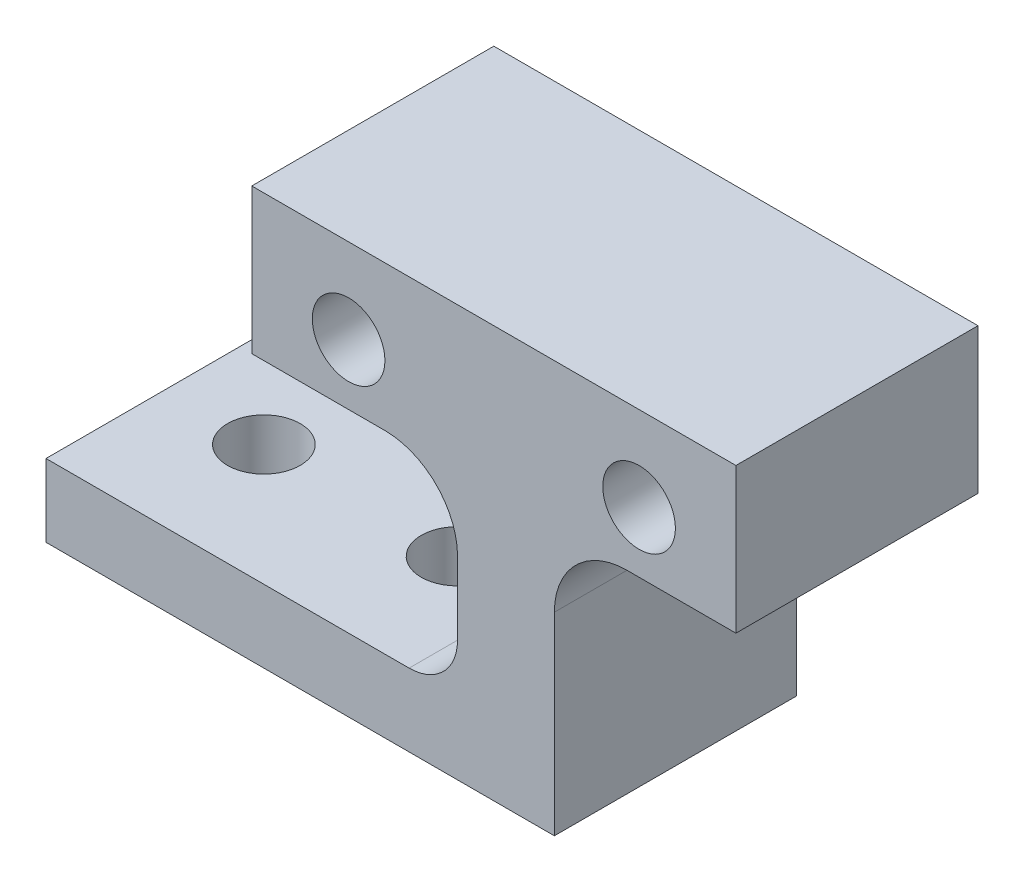
from build123d import *

# Parameters (mm, degrees)
SKETCH_1_W          = 20
SKETCH_1_H          = 10
EXTRUDE_1_DEPTH     = 5
SKETCH_2_R          = 1.5
CUT_EXTRUDE_1_DEPTH = 16
SKETCH_3_W          = 3
SKETCH_3_H          = 10
EXTRUDE_2_DEPTH     = 8
SKETCH_6_W          = 20
SKETCH_6_H          = 10
EXTRUDE_4_DEPTH     = 3
SKETCH_7_R          = 1.5
CUT_EXTRUDE_3_DEPTH = 24.157072354
FILLET_2_R          = 3
FILLET_4_R          = 2
SKETCH_11_W         = 10
SKETCH_11_H         = 11
EXTRUDE_7_DEPTH     = 1
FILLET_8_R          = 3
SKETCH_12_W         = 20
SKETCH_12_H         = 10
EXTRUDE_8_DEPTH     = 1


with BuildPart() as part:
    # 草图1 → 凸台-拉伸1 (new body)
    with BuildSketch(Plane(origin=(0, 0, 0), x_dir=(1, 0, 0), z_dir=(0, 1, 0))):
        Rectangle(SKETCH_1_W, SKETCH_1_H)
    extrude(amount=EXTRUDE_1_DEPTH)

    # 草图2 → 切除-拉伸1 (cut, through all)
    with BuildSketch(Plane.XY.offset(5)):
        with Locations((-6, 2.5)):
            Circle(SKETCH_2_R)
        with Locations((6, 2.5)):
            Circle(SKETCH_2_R)
    extrude(amount=-CUT_EXTRUDE_1_DEPTH, mode=Mode.SUBTRACT)

    # 草图3 → 凸台-拉伸2 (add)
    with BuildSketch(Plane.XZ):
        Rectangle(SKETCH_3_W, SKETCH_3_H)
    extrude(amount=EXTRUDE_2_DEPTH)

    # 草图6 → 凸台-拉伸4 (add)
    with BuildSketch(Plane.XZ.offset(8)):
        with Locations((-8.5, 0)):
            Rectangle(SKETCH_6_W, SKETCH_6_H)
    extrude(amount=EXTRUDE_4_DEPTH)

    # 草图7 → 切除-拉伸3 (cut, through all)
    with BuildSketch(Plane(origin=(0, -8, 0), x_dir=(1, 0, 0), z_dir=(0, 1, 0))):
        with Locations(Location((-14.5, 0, 0), (0, 0, 270))):
            Circle(SKETCH_7_R)
        with Locations(Location((-6.5, 0, 0), (0, 0, 270))):
            Circle(SKETCH_7_R)
    extrude(amount=-CUT_EXTRUDE_3_DEPTH, mode=Mode.SUBTRACT)

    # 圆角2
    fillet_2_edges = [part.edges().sort_by_distance(p)[0] for p in [
        (-1.5, 0, 0),
    ]]
    fillet(fillet_2_edges, radius=FILLET_2_R)

    # 圆角4
    fillet_4_edges = [part.edges().sort_by_distance(p)[0] for p in [
        (-1.5, -8, 0),
    ]]
    fillet(fillet_4_edges, radius=FILLET_4_R)

    # 草图11 → 凸台-拉伸7 (add)
    with BuildSketch(Plane(origin=(1.5, 0, 0), x_dir=(0, 0, -1), z_dir=(1, 0, 0))):
        with Locations((0, -5.5)):
            Rectangle(SKETCH_11_W, SKETCH_11_H)
    extrude(amount=EXTRUDE_7_DEPTH)

    # 圆角8
    fillet_8_edges = [part.edges().sort_by_distance(p)[0] for p in [
        (2.5, 0, 0),
    ]]
    fillet(fillet_8_edges, radius=FILLET_8_R)

    # 草图12 → 凸台-拉伸8 (add)
    with BuildSketch(Plane(origin=(0, 5, 0), x_dir=(1, 0, 0), z_dir=(0, 1, 0))):
        Rectangle(SKETCH_12_W, SKETCH_12_H)
    extrude(amount=EXTRUDE_8_DEPTH)


solid = part.part
